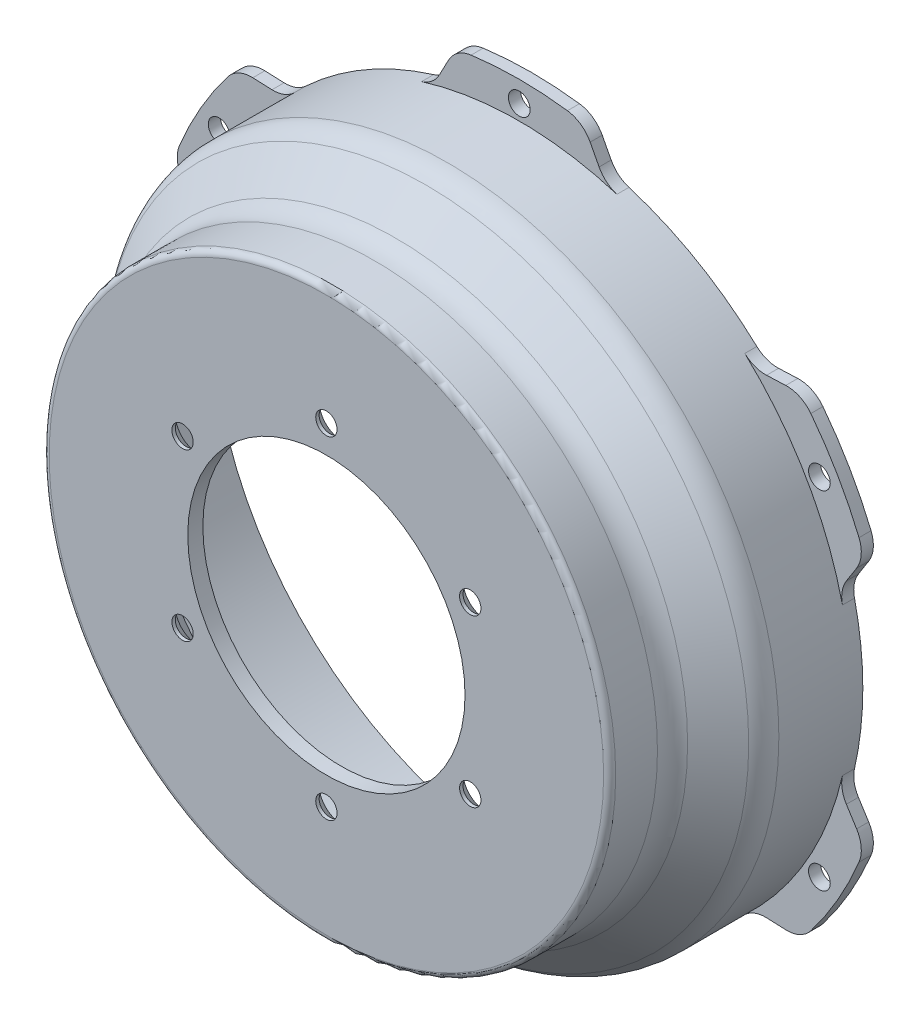
from build123d import *
from build123d.topology import SkipClean

# Parameters (mm, degrees)
CIRPATTERN2_COUNT  = 6
SKETCH8_R          = 2.286
CUT_EXTRUDE1_DEPTH = 117.853803532


with BuildPart() as part:
    # Sketch3 → Revolve1 (revolve)
    with BuildSketch(Plane(origin=(0, 0, 0), x_dir=(0, 0, -1), z_dir=(1, 0, 0)), mode=Mode.PRIVATE) as revolve1_sk:
        with BuildLine():
            Line((0, 29.21), (0, 58.42))
            ThreePointArc((0, 58.42), (0.371974388, 59.318025612), (1.27, 59.69))
            Line((1.27, 59.69), (10.069743879, 59.69))
            ThreePointArc((10.069743879, 59.69), (12.499783674, 60.173364969), (14.559871939, 61.549871939))
            Line((14.559871939, 61.549871939), (21.000128061, 67.990128061))
            ThreePointArc((21.000128061, 67.990128061), (23.060216326, 69.366635031), (25.490256121, 69.85))
            Line((25.490256121, 69.85), (40.64, 69.85))
            Line((40.64, 69.85), (40.64, 77.47))
            Line((40.64, 77.47), (43.18, 77.47))
            Line((43.18, 77.47), (43.18, 67.31))
            Line((43.18, 67.31), (24.1935, 67.31))
            Line((24.1935, 67.31), (14.0335, 57.15))
            Line((14.0335, 57.15), (8.4455, 57.15))
            Line((8.4455, 57.15), (8.4455, 54.61))
            Line((8.4455, 54.61), (4.445, 54.61))
            ThreePointArc((4.445, 54.61), (3.546974388, 54.238025612), (3.175, 53.34))
            Line((3.175, 53.34), (3.175, 29.21))
            Line((3.175, 29.21), (0, 29.21))
        make_face()
    revolve(revolve1_sk.sketch.rotate(Axis((0, 0, 0), (0, 0, -1)), 90), axis=Axis((0, 0, 0), (0, 0, -1)))

    # Sketch7 → CSK for M4 Countersunk Flat Head Screw2 (revolve, cut)
    with BuildSketch(Plane(origin=(0, 35, -3.175), x_dir=(0, 1, 0), z_dir=(1, 0, 0))):
        Polygon((0, 0), (0, 4.526936393), (2.25, 3.175), (2.25, 2.45), (4.7, 0), align=None)
    csk_for_m4_countersunk_flat_head_screw2 = revolve(axis=Axis((0, 35, -9.525), (0, 0, 1)), mode=Mode.SUBTRACT)

    # CirPattern2: CSK for M4 Countersunk Flat Head Screw2 ×6 about axis
    cirpattern2_axis = Axis((0, 0, 0), (0, 0, 1))
    for i in range(1, CIRPATTERN2_COUNT):
        add(csk_for_m4_countersunk_flat_head_screw2.rotate(cirpattern2_axis, i * 360 / CIRPATTERN2_COUNT), mode=Mode.SUBTRACT)

    # Sketch8 → Cut-Extrude1 (cut, through all)
    with SkipClean():  # the faces are left unmerged after this step: merging them gives an invalid solid
        with BuildSketch(Plane.XY.offset(-40.64)):
            with BuildLine():
                ThreePointArc((77.47, 0), (75.984990618, 15.095764333), (71.586894261, 29.612792338))
                ThreePointArc((71.586894261, 29.612792338), (72.045629184, 26.639866522), (71.084638604, 23.789388889))
                Line((71.084638604, 23.789388889), (68.920030414, 20.36953457))
                ThreePointArc((68.920030414, 20.36953457), (68.026910163, 18.04667064), (68.095090227, 15.558958417))
                ThreePointArc((68.095090227, 15.558958417), (69.409886012, 7.828807306), (69.85, 0))
                ThreePointArc((69.85, 0), (69.409886012, -7.828807306), (68.095090227, -15.558958417))
                ThreePointArc((68.095090227, -15.558958417), (68.026910163, -18.04667064), (68.920030414, -20.36953457))
                Line((68.920030414, -20.36953457), (71.084638604, -23.789388889))
                ThreePointArc((71.084638604, -23.789388889), (72.045629184, -26.639866522), (71.586894261, -29.612792338))
                ThreePointArc((71.586894261, -29.612792338), (75.984990618, -15.095764333), (77.47, 0))
            make_face()
            with BuildLine():
                ThreePointArc((10.148016689, -76.802465177), (38.735, -67.090988031), (61.438877572, -47.189672839))
                ThreePointArc((61.438877572, -47.189672839), (59.093615754, -49.073411844), (56.14453442, -49.666408405))
                Line((56.14453442, -49.666408405), (52.100549608, -49.501729883))
                ThreePointArc((52.100549608, -49.501729883), (49.642330309, -49.889697022), (47.521998359, -51.192598801))
                ThreePointArc((47.521998359, -51.192598801), (41.484889014, -56.196320907), (34.925, -60.491874454))
                ThreePointArc((34.925, -60.491874454), (27.924996998, -64.025128213), (20.573091868, -66.751557218))
                ThreePointArc((20.573091868, -66.751557218), (18.384579854, -67.936367662), (16.819480806, -69.871264453))
                Line((16.819480806, -69.871264453), (14.940104183, -73.455797294))
                ThreePointArc((14.940104183, -73.455797294), (12.952013431, -75.713278366), (10.148016689, -76.802465177))
            make_face()
            with BuildLine():
                ThreePointArc((-56.14453442, -49.666408405), (-59.093615754, -49.073411844), (-61.438877572, -47.189672839))
                ThreePointArc((-61.438877572, -47.189672839), (-38.735, -67.090988031), (-10.148016689, -76.802465177))
                ThreePointArc((-10.148016689, -76.802465177), (-12.952013431, -75.713278366), (-14.940104183, -73.455797294))
                Line((-14.940104183, -73.455797294), (-16.819480806, -69.871264453))
                ThreePointArc((-16.819480806, -69.871264453), (-18.384579854, -67.936367662), (-20.573091868, -66.751557218))
                ThreePointArc((-20.573091868, -66.751557218), (-27.924996998, -64.025128213), (-34.925, -60.491874454))
                ThreePointArc((-34.925, -60.491874454), (-41.484889014, -56.196320907), (-47.521998359, -51.192598801))
                ThreePointArc((-47.521998359, -51.192598801), (-49.642330309, -49.889697022), (-52.100549608, -49.501729883))
                Line((-52.100549608, -49.501729883), (-56.14453442, -49.666408405))
            make_face()
            with BuildLine():
                ThreePointArc((-71.084638604, 23.789388889), (-72.045629184, 26.639866522), (-71.586894261, 29.612792338))
                ThreePointArc((-71.586894261, 29.612792338), (-77.47, 0), (-71.586894261, -29.612792338))
                ThreePointArc((-71.586894261, -29.612792338), (-72.045629184, -26.639866522), (-71.084638604, -23.789388889))
                Line((-71.084638604, -23.789388889), (-68.920030414, -20.36953457))
                ThreePointArc((-68.920030414, -20.36953457), (-68.026910163, -18.04667064), (-68.095090227, -15.558958417))
                ThreePointArc((-68.095090227, -15.558958417), (-69.409886012, -7.828807306), (-69.85, 0))
                ThreePointArc((-69.85, 0), (-69.409886012, 7.828807306), (-68.095090227, 15.558958417))
                ThreePointArc((-68.095090227, 15.558958417), (-68.026910163, 18.04667064), (-68.920030414, 20.36953457))
                Line((-68.920030414, 20.36953457), (-71.084638604, 23.789388889))
            make_face()
            with BuildLine():
                ThreePointArc((-14.940104183, 73.455797294), (-12.952013431, 75.713278366), (-10.148016689, 76.802465177))
                ThreePointArc((-10.148016689, 76.802465177), (-38.735, 67.090988031), (-61.438877572, 47.189672839))
                ThreePointArc((-61.438877572, 47.189672839), (-59.093615754, 49.073411844), (-56.14453442, 49.666408405))
                Line((-56.14453442, 49.666408405), (-52.100549608, 49.501729883))
                ThreePointArc((-52.100549608, 49.501729883), (-49.642330309, 49.889697022), (-47.521998359, 51.192598801))
                ThreePointArc((-47.521998359, 51.192598801), (-41.484889014, 56.196320907), (-34.925, 60.491874454))
                ThreePointArc((-34.925, 60.491874454), (-27.924996998, 64.025128213), (-20.573091868, 66.751557218))
                ThreePointArc((-20.573091868, 66.751557218), (-18.384579854, 67.936367662), (-16.819480806, 69.871264453))
                Line((-16.819480806, 69.871264453), (-14.940104183, 73.455797294))
            make_face()
            with BuildLine():
                ThreePointArc((10.148016689, 76.802465177), (12.952013431, 75.713278366), (14.940104183, 73.455797294))
                Line((14.940104183, 73.455797294), (16.819480806, 69.871264453))
                ThreePointArc((16.819480806, 69.871264453), (18.384579854, 67.936367662), (20.573091868, 66.751557218))
                ThreePointArc((20.573091868, 66.751557218), (27.924996998, 64.025128213), (34.925, 60.491874454))
                ThreePointArc((34.925, 60.491874454), (41.484889014, 56.196320907), (47.521998359, 51.192598801))
                ThreePointArc((47.521998359, 51.192598801), (49.642330309, 49.889697022), (52.100549608, 49.501729883))
                Line((52.100549608, 49.501729883), (56.14453442, 49.666408405))
                ThreePointArc((56.14453442, 49.666408405), (59.093615754, 49.073411844), (61.438877572, 47.189672839))
                ThreePointArc((61.438877572, 47.189672839), (38.735, 67.090988031), (10.148016689, 76.802465177))
            make_face()
            with Locations((0, 73.025)):
                Circle(SKETCH8_R)
            with Locations((63.241505111, 36.5125)):
                Circle(SKETCH8_R)
            with Locations((-63.241505111, 36.5125)):
                Circle(SKETCH8_R)
            with Locations((-63.241505111, -36.5125)):
                Circle(SKETCH8_R)
            with Locations((63.241505111, -36.5125)):
                Circle(SKETCH8_R)
            with Locations((0, -73.025)):
                Circle(SKETCH8_R)
        extrude(amount=-CUT_EXTRUDE1_DEPTH, mode=Mode.SUBTRACT)


solid = part.part
